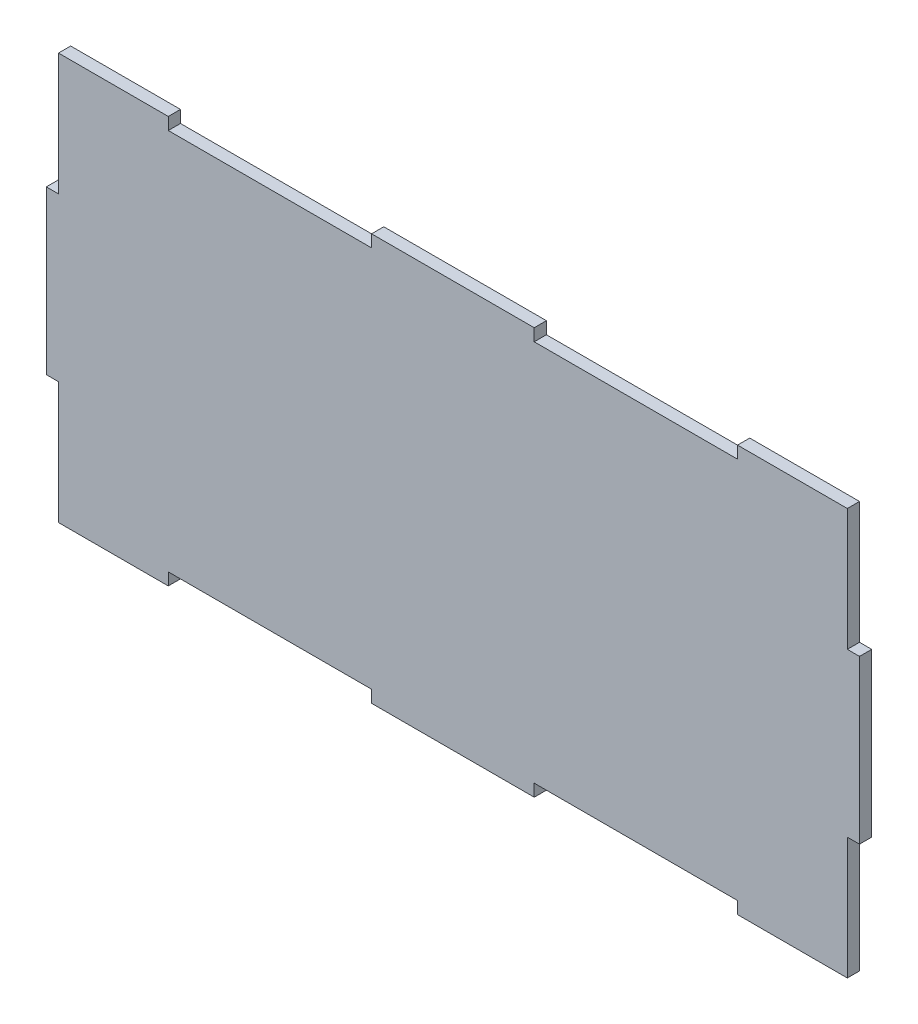
from build123d import *

# Parameters (mm, degrees)
BOSS_EXTRU_1_DEPTH = 3


with BuildPart() as part:
    # Esquisse2 → Boss.-Extru.1 (new body)
    with BuildSketch(Plane.XY):
        Polygon((26.963895135, 9.191113465), (66.963895135, 9.191113465), (66.963895135, 6.191113465), (116.963895135, 6.191113465), (116.963895135, 9.191113465), (143.963895135, 9.191113465), (143.963895135, -20.808886535), (146.963895135, -20.808886535), (146.963895135, -60.808886535), (143.963895135, -60.808886535), (143.963895135, -90.808886535), (116.963895135, -90.808886535), (116.963895135, -87.808886535), (66.963895135, -87.808886535), (66.963895135, -90.808886535), (26.963895135, -90.808886535), (26.963895135, -87.808886535), (-23.036104865, -87.808886535), (-23.036104865, -90.808886535), (-50.036104865, -90.808886535), (-50.036104865, -60.808886535), (-53.036104865, -60.808886535), (-53.036104865, -20.808886535), (-50.036104865, -20.808886535), (-50.036104865, 9.191113465), (-23.036104865, 9.191113465), (-23.036104865, 6.191113465), (26.963895135, 6.191113465), align=None)
    extrude(amount=BOSS_EXTRU_1_DEPTH)


solid = part.part
